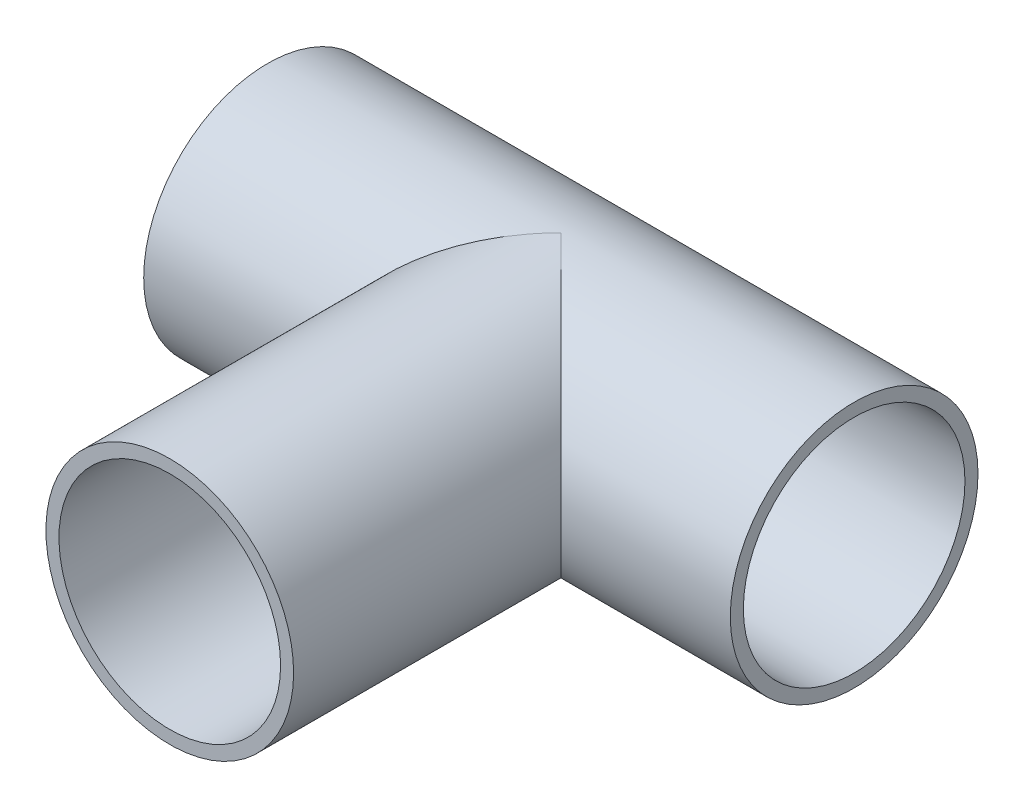
from build123d import *

# Parameters (mm, degrees)
SKETCH1_R               = 19
SKETCH1_R_2             = 17
CUT_EXTRUDE1_DEPTH      = 93.881645167
CUT_EXTRUDE1_DEPTH_BACK = 93.881645167
SKETCH3_R               = 17


with BuildPart() as part:
    # Sweep1: sweep along a path in Sketch2
    with BuildLine(Plane(origin=(0, 0, 0), x_dir=(1, 0, 0), z_dir=(0, 1, 0))) as sweep1_path:
        Line((0, 0), (0, 60))
        Line((0, 60), (-45, 60))
    # Sketch1 → Sweep1 (sweep)
    with BuildSketch(Plane.XY):
        Circle(SKETCH1_R)
        Circle(SKETCH1_R_2, mode=Mode.SUBTRACT)
    sweep(path=sweep1_path.line, transition=Transition.RIGHT)

    # Mirror1: part across plane


with BuildPart() as part_1:
    add(part.part)
    add(part.part.mirror(Plane(origin=(0, 0, 0), x_dir=(0, 0, 1), z_dir=(1, 0, 0))))

    # Sketch3 → Cut-Extrude1 (cut, two sides: drawn at the far end of the back side and taken through both)
    with BuildSketch(Plane(origin=(0, 0, 0), x_dir=(0, 0, -1), z_dir=(1, 0, 0)).offset(-CUT_EXTRUDE1_DEPTH_BACK)):
        with Locations((60, 0)):
            Circle(SKETCH3_R)
    extrude(amount=CUT_EXTRUDE1_DEPTH + CUT_EXTRUDE1_DEPTH_BACK, mode=Mode.SUBTRACT)


solid = part_1.part
